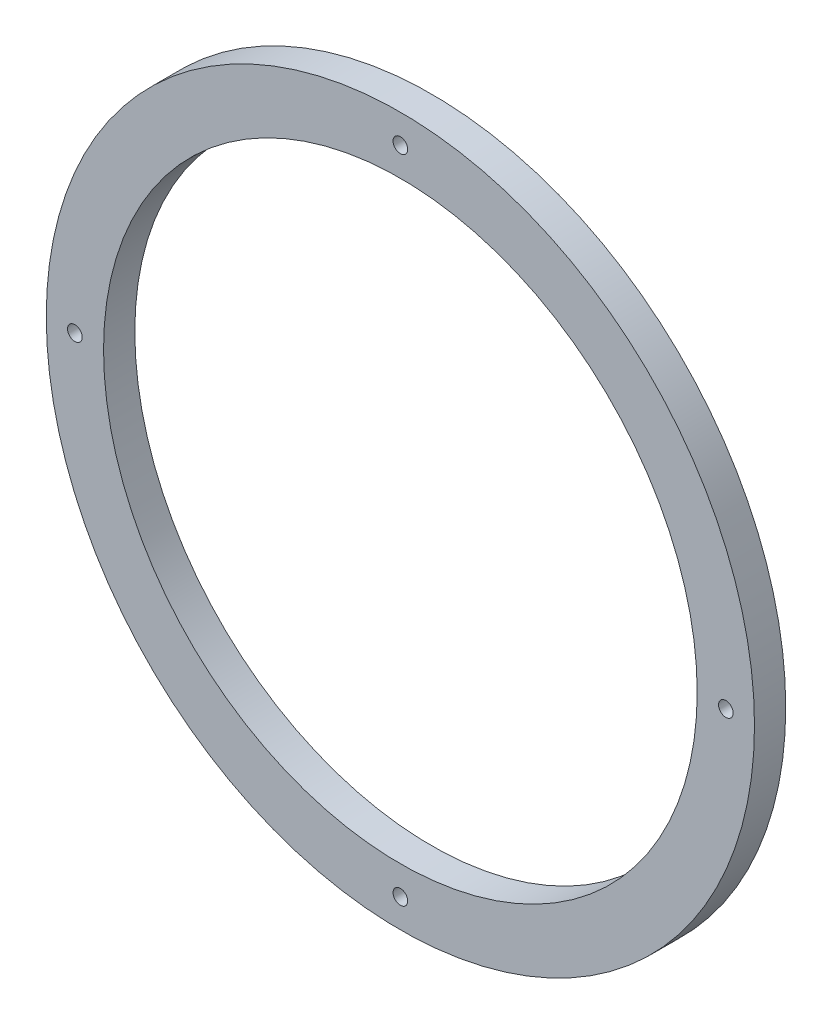
from build123d import *

# Parameters (mm, degrees)
SKETCH1_R           = 86.36
SKETCH1_R_2         = 72.39
SKETCH1_R_3         = 1.7859375
BOSS_EXTRUDE1_DEPTH = 7.62


with BuildPart() as part:
    # Sketch1 → Boss-Extrude1 (new body)
    with BuildSketch(Plane.XY):
        with Locations(Location((0, 0, 0), (0, 0, 180))):
            Circle(SKETCH1_R)
        with Locations(Location((0, 0, 0), (0, 0, 180))):
            Circle(SKETCH1_R_2, mode=Mode.SUBTRACT)
        with Locations(Location((0, 79.375, 0), (0, 0, 180))):
            Circle(SKETCH1_R_3, mode=Mode.SUBTRACT)
        with Locations(Location((79.375, 0, 0), (0, 0, 180))):
            Circle(SKETCH1_R_3, mode=Mode.SUBTRACT)
        with Locations(Location((0, -79.375, 0), (0, 0, 180))):
            Circle(SKETCH1_R_3, mode=Mode.SUBTRACT)
        with Locations(Location((-79.375, 0, 0), (0, 0, 180))):
            Circle(SKETCH1_R_3, mode=Mode.SUBTRACT)
    extrude(amount=BOSS_EXTRUDE1_DEPTH)


solid = part.part
